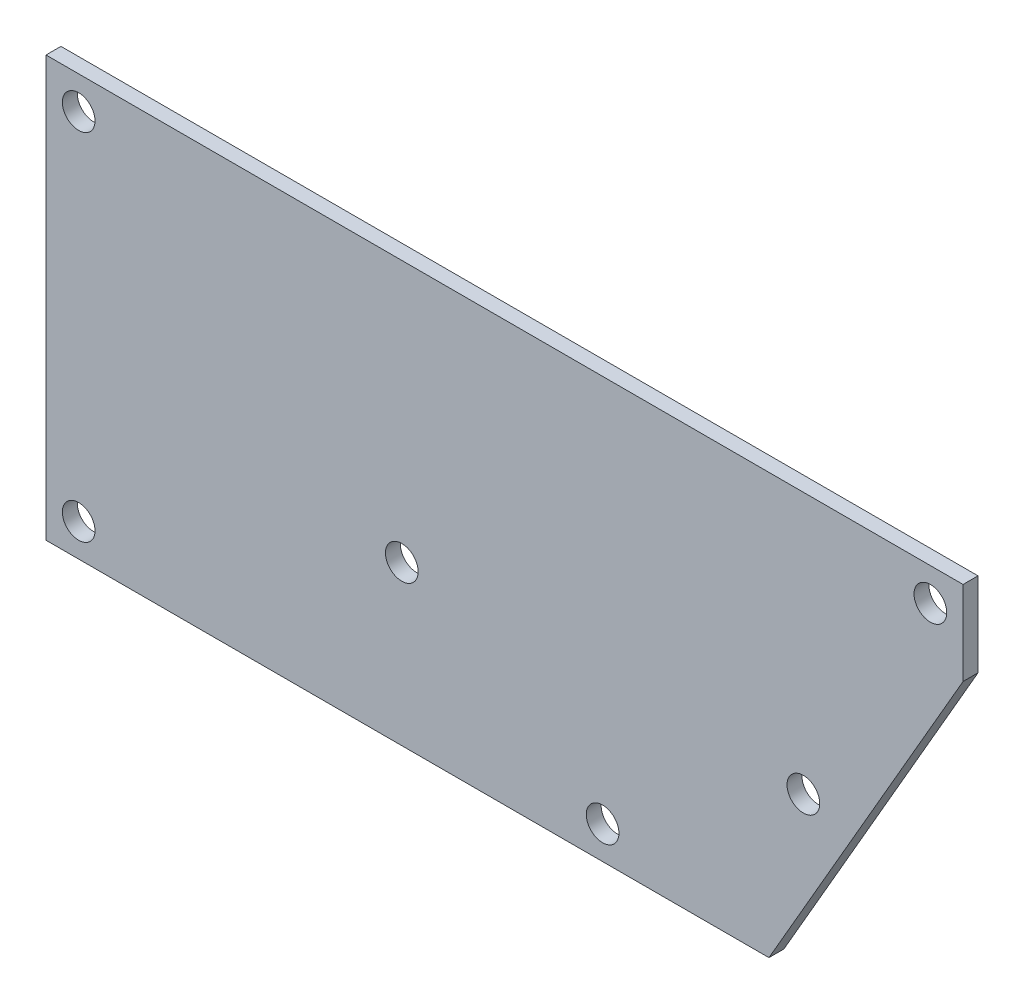
from build123d import *

# Parameters (mm, degrees)
PCB_R               = 1.75
BOSS_EXTRUDE1_DEPTH = 1.6


with BuildPart() as part:
    # PCB (on Front Plane) → Boss-Extrude1 (new body)
    with BuildSketch(Plane.XY):
        Polygon((-49.098, 15), (-49.098, -24), (28.313390309, -24), (49.098, 12), (49.098, 21), (-49.098, 21), align=None)
        with Locations((45.598, 17.5)):
            Circle(PCB_R, mode=Mode.SUBTRACT)
        with Locations((10.5, -20.5)):
            Circle(PCB_R, mode=Mode.SUBTRACT)
        with Locations((32, -7)):
            Circle(PCB_R, mode=Mode.SUBTRACT)
        with Locations((-11, -7)):
            Circle(PCB_R, mode=Mode.SUBTRACT)
        with Locations((-45.598, 17.5)):
            Circle(PCB_R, mode=Mode.SUBTRACT)
        with Locations((-45.598, -20.5)):
            Circle(PCB_R, mode=Mode.SUBTRACT)
    extrude(amount=BOSS_EXTRUDE1_DEPTH)


solid = part.part
